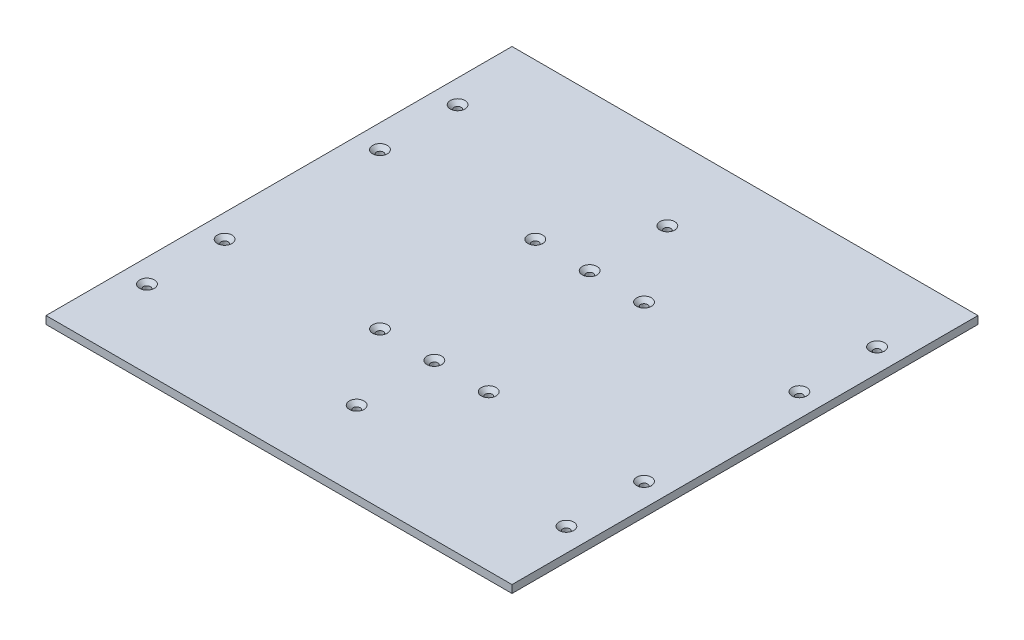
from build123d import *

# Parameters (mm, degrees)
SKETCH1_W           = 300
SKETCH1_H           = 5
BOSS_EXTRUDE1_DEPTH = 150
SKETCH2_R           = 2.25
CUT_EXTRUDE1_DEPTH  = 213.190951739
SKETCH3_R           = 2.25
CUT_EXTRUDE2_DEPTH  = 213.190951739
CHAMFER1_SIZE       = 2.5


with BuildPart() as part:
    # Sketch1 → Boss-Extrude1 (new, symmetric)
    with BuildSketch(Plane.XY):
        with Locations((0, 2.5)):
            Rectangle(SKETCH1_W, SKETCH1_H)
    extrude(amount=BOSS_EXTRUDE1_DEPTH, both=True)

    # Sketch2 → Cut-Extrude1 (cut, through all)
    with BuildSketch(Plane(origin=(0, 5, 0), x_dir=(1, 0, 0), z_dir=(0, 1, 0))):
        with Locations(Location((0, 100, 0), (0, 0, 270))):
            Circle(SKETCH2_R)
        with Locations(Location((0, 50, 0), (0, 0, 270))):
            Circle(SKETCH2_R)
        with Locations(Location((-35, 50, 0), (0, 0, 270))):
            Circle(SKETCH2_R)
        with Locations(Location((35, 50, 0), (0, 0, 270))):
            Circle(SKETCH2_R)
        with Locations(Location((0, -100, 0), (0, 0, 90))):
            Circle(SKETCH2_R)
        with Locations(Location((-35, -50, 0), (0, 0, 90))):
            Circle(SKETCH2_R)
        with Locations(Location((0, -50, 0), (0, 0, 90))):
            Circle(SKETCH2_R)
        with Locations(Location((35, -50, 0), (0, 0, 90))):
            Circle(SKETCH2_R)
    extrude(amount=-CUT_EXTRUDE1_DEPTH, mode=Mode.SUBTRACT)

    # Sketch3 → Cut-Extrude2 (cut, through all)
    with BuildSketch(Plane(origin=(0, 0, 0), x_dir=(-1, 0, 0), z_dir=(0, -1, 0))):
        with Locations(Location((-135, -100, 0), (0, 0, 90))):
            Circle(SKETCH3_R)
        with Locations(Location((-135, -50, 0), (0, 0, 90))):
            Circle(SKETCH3_R)
        with Locations(Location((-135, 50, 0), (0, 0, 90))):
            Circle(SKETCH3_R)
        with Locations(Location((-135, 100, 0), (0, 0, 90))):
            Circle(SKETCH3_R)
        with Locations(Location((135, -100, 0), (0, 0, 90))):
            Circle(SKETCH3_R)
        with Locations(Location((135, 50, 0), (0, 0, 90))):
            Circle(SKETCH3_R)
        with Locations(Location((135, 100, 0), (0, 0, 90))):
            Circle(SKETCH3_R)
        with Locations(Location((135, -50, 0), (0, 0, 90))):
            Circle(SKETCH3_R)
    extrude(amount=-CUT_EXTRUDE2_DEPTH, mode=Mode.SUBTRACT)

    # Chamfer1
    chamfer1_edges = [part.edges().sort_by_distance(p)[0] for p in [
        (0, 5, -102.25),
        (35, 5, 52.25),
        (0, 5, 52.25),
        (-35, 5, 52.25),
        (0, 5, -52.25),
        (-35, 5, -52.25),
        (35, 5, -52.25),
        (0, 5, 102.25),
        (-135, 5, 102.25),
        (135, 5, -97.75),
        (135, 5, -47.75),
        (135, 5, 52.25),
        (-135, 5, -47.75),
        (-135, 5, -97.75),
        (-135, 5, 52.25),
        (135, 5, 102.25),
    ]]
    chamfer(chamfer1_edges, length=CHAMFER1_SIZE)


solid = part.part
